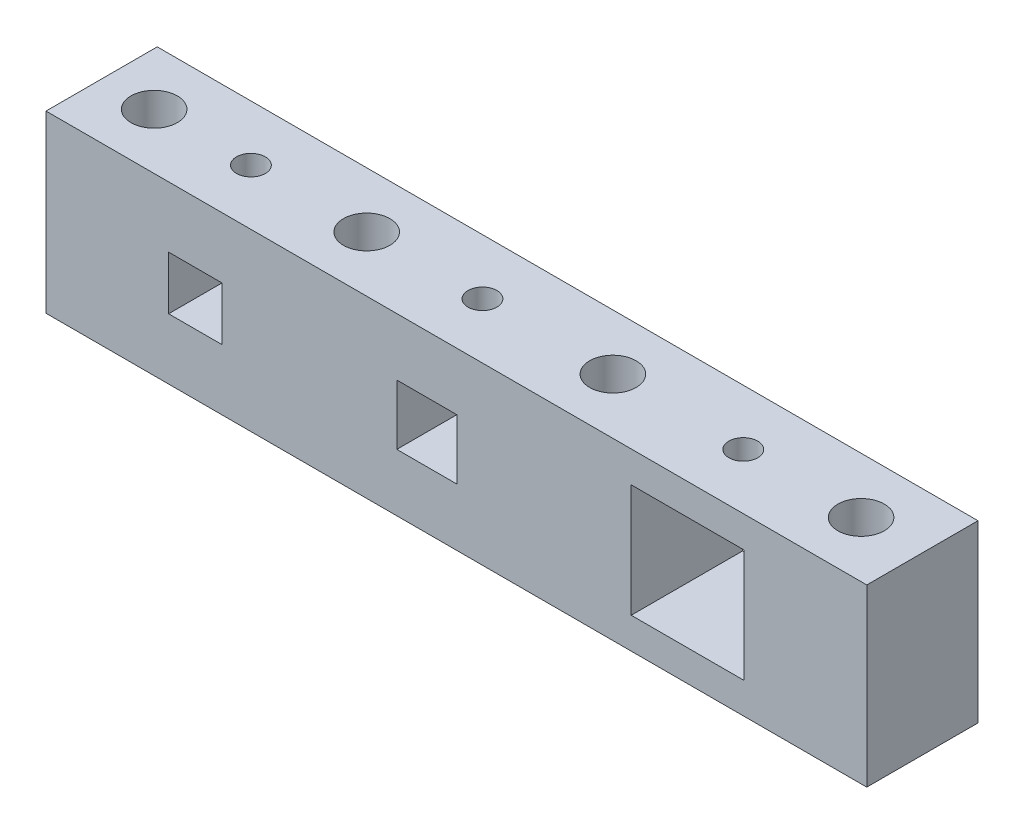
from build123d import *

# Parameters (mm, degrees)
SKETCH1_W                       = 93.728
SKETCH1_H                       = 20
SKETCH1_W_2                     = 6.1
SKETCH1_H_2                     = 6.1
SKETCH1_W_3                     = 6.858
SKETCH1_H_3                     = 6.858
SKETCH1_W_4                     = 12.9
SKETCH1_H_4                     = 12.9
BOSS_EXTRUDE1_DEPTH             = 12.7
TAP_DRILL_FOR_M4X0_7_TAP1_D     = 3.3
TAP_DRILL_FOR_M4X0_7_TAP1_DEPTH = 6.95
M5_CLEARANCE_HOLE1_D            = 5.3


with BuildPart() as part:
    # Sketch1 → Boss-Extrude1 (new body)
    with BuildSketch(Plane.XY):
        with Locations((3.375, 0)):
            Rectangle(SKETCH1_W, SKETCH1_H)
        with Locations((-26.439, 0)):
            Rectangle(SKETCH1_W_2, SKETCH1_H_2, mode=Mode.SUBTRACT)
        Rectangle(SKETCH1_W_3, SKETCH1_H_3, mode=Mode.SUBTRACT)
        with Locations((29.789, 0)):
            Rectangle(SKETCH1_W_4, SKETCH1_H_4, mode=Mode.SUBTRACT)
    extrude(amount=BOSS_EXTRUDE1_DEPTH)

    # Tap Drill for M4x0.7 Tap1
    with Locations(Plane(origin=(-26.439, 10, 6.35), x_dir=(0, 0, 1), z_dir=(0, 1, 0))):
        with Locations((0, 0), (0, 26.439), (0, 56.228)):
            Hole(TAP_DRILL_FOR_M4X0_7_TAP1_D / 2, depth=TAP_DRILL_FOR_M4X0_7_TAP1_DEPTH)

    # M5 Clearance Hole1 (through all)
    with Locations(Plane(origin=(-37.489, 10, 6.35), x_dir=(0, 0, 1), z_dir=(0, 1, 0))):
        with Locations((0, 0), (0, 24.2695), (0, 52.3835), (0, 80.728)):
            Hole(M5_CLEARANCE_HOLE1_D / 2)


solid = part.part
